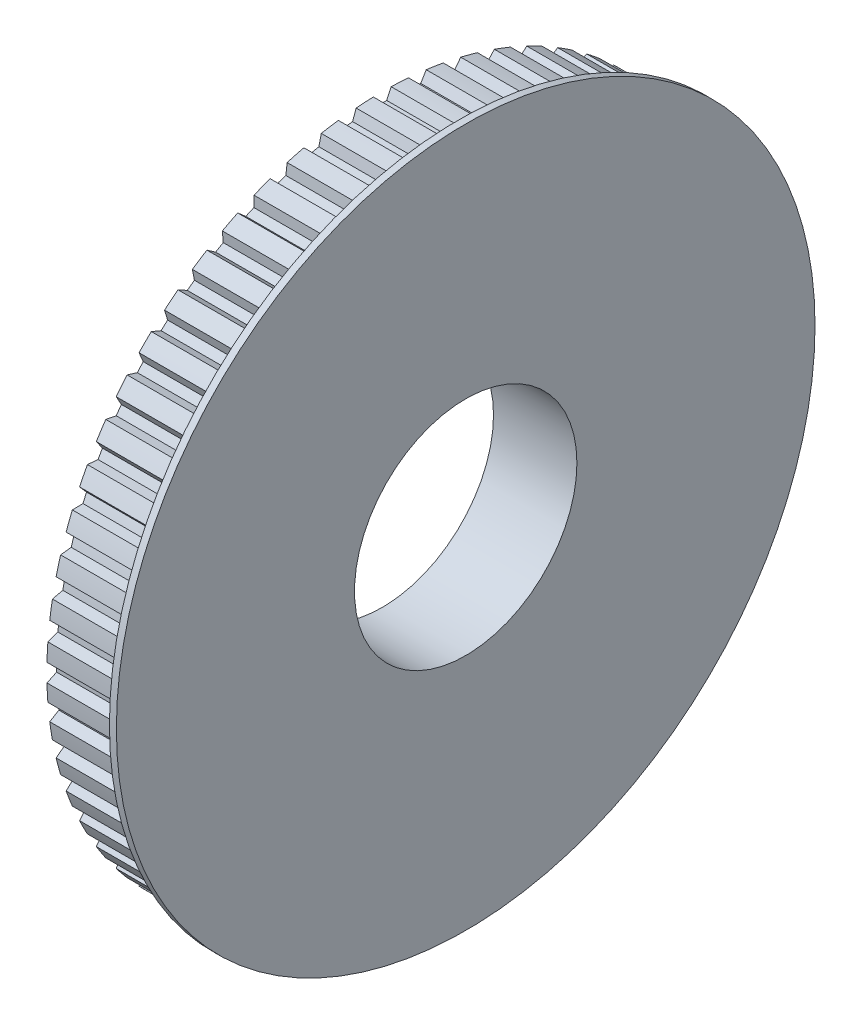
from build123d import *

# Parameters (mm, degrees)
SKETCH1_R           = 48.255
SKETCH1_R_2         = 16
BOSS_EXTRUDE1_DEPTH = 11
CUT_EXTRUDE1_DEPTH  = 70.123730006
SKETCH4_R           = 50.255
SKETCH4_R_2         = 16
BOSS_EXTRUDE2_DEPTH = 1


with BuildPart() as part:
    # Sketch1 → Boss-Extrude1 (new body)
    with BuildSketch(Plane(origin=(0, 0, 0), x_dir=(0, 0, -1), z_dir=(1, 0, 0))):
        Circle(SKETCH1_R)
        Circle(SKETCH1_R_2, mode=Mode.SUBTRACT)
    extrude(amount=BOSS_EXTRUDE1_DEPTH)

    # Sketch2 → Cut-Extrude1 (cut, through all)
    with BuildSketch(Plane.ZY):
        with BuildLine():
            Line((1.281876834, 48.237970695), (0.634980562, 46.850697163))
            ThreePointArc((0.634980562, 46.850697163), (0, 46.855), (-0.634980562, 46.850697163))
            Line((-0.634980562, 46.850697163), (-1.281876834, 48.237970695))
            ThreePointArc((-1.281876834, 48.237970695), (0, 48.255), (1.281876834, 48.237970695))
        make_face()
        with BuildLine():
            Line((6.317095526, 47.839725429), (5.528733449, 46.5276706))
            ThreePointArc((5.528733449, 46.5276706), (4.897681146, 46.598323407), (4.265729306, 46.660417684))
            Line((4.265729306, 46.660417684), (3.76738637, 48.10771066))
            ThreePointArc((3.76738637, 48.10771066), (5.044020995, 47.990654061), (6.317095526, 47.839725429))
        make_face()
        with BuildLine():
            Line((11.283102798, 46.91733812), (10.361912376, 45.694877141))
            ThreePointArc((10.361912376, 45.694877141), (9.741702273, 45.831105832), (9.11970295, 45.958916905))
            Line((9.11970295, 45.958916905), (8.775373299, 47.45037248))
            ThreePointArc((8.775373299, 47.45037248), (10.03277864, 47.200512473), (11.283102798, 46.91733812))
        make_face()
        with BuildLine():
            Line((16.125490035, 45.480914636), (15.081564023, 44.361441045))
            ThreePointArc((15.081564023, 44.361441045), (14.478991271, 44.561753071), (13.873759221, 44.753880615))
            Line((13.873759221, 44.753880615), (13.687215403, 46.273158089))
            ThreePointArc((13.687215403, 46.273158089), (14.911615064, 45.893232194), (16.125490035, 45.480914636))
        make_face()
        with BuildLine():
            Line((20.791203028, 43.546192734), (19.635978898, 42.541971719))
            ThreePointArc((19.635978898, 42.541971719), (19.057645411, 42.804172418), (18.475811682, 43.058511443))
            Line((18.475811682, 43.058511443), (18.449097511, 44.588965295))
            ThreePointArc((18.449097511, 44.588965295), (19.627076712, 44.083136059), (20.791203028, 43.546192734))
        make_face()
        with BuildLine():
            Line((25.22912325, 41.134369632), (23.975257879, 40.256403647))
            ThreePointArc((23.975257879, 40.256403647), (23.4275, 40.577620294), (22.875439284, 40.891384209))
            Line((22.875439284, 40.891384209), (23.008847445, 42.416246466))
            ThreePointArc((23.008847445, 42.416246466), (24.1275, 41.79005586), (25.22912325, 41.134369632))
        make_face()
        with BuildLine():
            Line((29.390627918, 38.271869768), (28.051858918, 37.529777994))
            ThreePointArc((28.051858918, 37.529777994), (27.540677996, 37.906491271), (27.024438787, 38.276242413))
            Line((27.024438787, 38.276242413), (27.316507632, 39.778806365))
            ThreePointArc((27.316507632, 39.778806365), (28.363577349, 39.039115064), (29.390627918, 38.271869768))
        make_face()
        with BuildLine():
            Line((33.230122717, 34.990055291), (31.82111792, 34.391968239))
            ThreePointArc((31.82111792, 34.391968239), (31.352114561, 34.820050798), (30.877352882, 35.241738095))
            Line((30.877352882, 35.241738095), (31.324882445, 36.705541337))
            ThreePointArc((31.324882445, 36.705541337), (32.28889741, 35.860453553), (33.230122717, 34.990055291))
        make_face()
        with BuildLine():
            Line((36.705541337, 31.324882445), (35.241738095, 30.877352882))
            ThreePointArc((35.241738095, 30.877352882), (34.820050798, 31.352114561), (34.391968239, 31.82111792))
            Line((34.391968239, 31.82111792), (34.990055291, 33.230122717))
            ThreePointArc((34.990055291, 33.230122717), (35.860453553, 32.28889741), (36.705541337, 31.324882445))
        make_face()
        with BuildLine():
            Line((39.778806365, 27.316507632), (38.276242413, 27.024438787))
            ThreePointArc((38.276242413, 27.024438787), (37.906491271, 27.540677996), (37.529777994, 28.051858918))
            Line((37.529777994, 28.051858918), (38.271869768, 29.390627918))
            ThreePointArc((38.271869768, 29.390627918), (39.039115064, 28.363577349), (39.778806365, 27.316507632))
        make_face()
        with BuildLine():
            Line((42.416246466, 23.008847445), (40.891384209, 22.875439284))
            ThreePointArc((40.891384209, 22.875439284), (40.577620294, 23.4275), (40.256403647, 23.975257879))
            Line((40.256403647, 23.975257879), (41.134369632, 25.22912325))
            ThreePointArc((41.134369632, 25.22912325), (41.79005586, 24.1275), (42.416246466, 23.008847445))
        make_face()
        with BuildLine():
            Line((44.588965295, 18.449097511), (43.058511443, 18.475811682))
            ThreePointArc((43.058511443, 18.475811682), (42.804172418, 19.057645411), (42.541971719, 19.635978898))
            Line((42.541971719, 19.635978898), (43.546192734, 20.791203028))
            ThreePointArc((43.546192734, 20.791203028), (44.083136059, 19.627076712), (44.588965295, 18.449097511))
        make_face()
        with BuildLine():
            Line((46.273158089, 13.687215403), (44.753880615, 13.873759221))
            ThreePointArc((44.753880615, 13.873759221), (44.561753071, 14.478991271), (44.361441045, 15.081564023))
            Line((44.361441045, 15.081564023), (45.480914636, 16.125490035))
            ThreePointArc((45.480914636, 16.125490035), (45.893232194, 14.911615064), (46.273158089, 13.687215403))
        make_face()
        with BuildLine():
            Line((47.45037248, 8.775373299), (45.958916905, 9.11970295))
            ThreePointArc((45.958916905, 9.11970295), (45.831105832, 9.741702273), (45.694877141, 10.361912376))
            Line((45.694877141, 10.361912376), (46.91733812, 11.283102798))
            ThreePointArc((46.91733812, 11.283102798), (47.200512473, 10.03277864), (47.45037248, 8.775373299))
        make_face()
        with BuildLine():
            Line((48.10771066, 3.76738637), (46.660417684, 4.265729306))
            ThreePointArc((46.660417684, 4.265729306), (46.598323407, 4.897681146), (46.5276706, 5.528733449))
            Line((46.5276706, 5.528733449), (47.839725429, 6.317095526))
            ThreePointArc((47.839725429, 6.317095526), (47.990654061, 5.044020995), (48.10771066, 3.76738637))
        make_face()
        with BuildLine():
            Line((48.237970695, -1.281876834), (46.850697163, -0.634980562))
            ThreePointArc((46.850697163, -0.634980562), (46.855, 0), (46.850697163, 0.634980562))
            Line((46.850697163, 0.634980562), (48.237970695, 1.281876834))
            ThreePointArc((48.237970695, 1.281876834), (48.255, 0), (48.237970695, -1.281876834))
        make_face()
        with BuildLine():
            Line((47.839725429, -6.317095526), (46.5276706, -5.528733449))
            ThreePointArc((46.5276706, -5.528733449), (46.598323407, -4.897681146), (46.660417684, -4.265729306))
            Line((46.660417684, -4.265729306), (48.10771066, -3.76738637))
            ThreePointArc((48.10771066, -3.76738637), (47.990654061, -5.044020995), (47.839725429, -6.317095526))
        make_face()
        with BuildLine():
            Line((46.91733812, -11.283102798), (45.694877141, -10.361912376))
            ThreePointArc((45.694877141, -10.361912376), (45.831105832, -9.741702273), (45.958916905, -9.11970295))
            Line((45.958916905, -9.11970295), (47.45037248, -8.775373299))
            ThreePointArc((47.45037248, -8.775373299), (47.200512473, -10.03277864), (46.91733812, -11.283102798))
        make_face()
        with BuildLine():
            Line((45.480914636, -16.125490035), (44.361441045, -15.081564023))
            ThreePointArc((44.361441045, -15.081564023), (44.561753071, -14.478991271), (44.753880615, -13.873759221))
            Line((44.753880615, -13.873759221), (46.273158089, -13.687215403))
            ThreePointArc((46.273158089, -13.687215403), (45.893232194, -14.911615064), (45.480914636, -16.125490035))
        make_face()
        with BuildLine():
            Line((43.546192734, -20.791203028), (42.541971719, -19.635978898))
            ThreePointArc((42.541971719, -19.635978898), (42.804172418, -19.057645411), (43.058511443, -18.475811682))
            Line((43.058511443, -18.475811682), (44.588965295, -18.449097511))
            ThreePointArc((44.588965295, -18.449097511), (44.083136059, -19.627076712), (43.546192734, -20.791203028))
        make_face()
        with BuildLine():
            Line((41.134369632, -25.22912325), (40.256403647, -23.975257879))
            ThreePointArc((40.256403647, -23.975257879), (40.577620294, -23.4275), (40.891384209, -22.875439284))
            Line((40.891384209, -22.875439284), (42.416246466, -23.008847445))
            ThreePointArc((42.416246466, -23.008847445), (41.79005586, -24.1275), (41.134369632, -25.22912325))
        make_face()
        with BuildLine():
            Line((38.271869768, -29.390627918), (37.529777994, -28.051858918))
            ThreePointArc((37.529777994, -28.051858918), (37.906491271, -27.540677996), (38.276242413, -27.024438787))
            Line((38.276242413, -27.024438787), (39.778806365, -27.316507632))
            ThreePointArc((39.778806365, -27.316507632), (39.039115064, -28.363577349), (38.271869768, -29.390627918))
        make_face()
        with BuildLine():
            Line((34.990055291, -33.230122717), (34.391968239, -31.82111792))
            ThreePointArc((34.391968239, -31.82111792), (34.820050798, -31.352114561), (35.241738095, -30.877352882))
            Line((35.241738095, -30.877352882), (36.705541337, -31.324882445))
            ThreePointArc((36.705541337, -31.324882445), (35.860453553, -32.28889741), (34.990055291, -33.230122717))
        make_face()
        with BuildLine():
            Line((31.324882445, -36.705541337), (30.877352882, -35.241738095))
            ThreePointArc((30.877352882, -35.241738095), (31.352114561, -34.820050798), (31.82111792, -34.391968239))
            Line((31.82111792, -34.391968239), (33.230122717, -34.990055291))
            ThreePointArc((33.230122717, -34.990055291), (32.28889741, -35.860453553), (31.324882445, -36.705541337))
        make_face()
        with BuildLine():
            Line((27.316507632, -39.778806365), (27.024438787, -38.276242413))
            ThreePointArc((27.024438787, -38.276242413), (27.540677996, -37.906491271), (28.051858918, -37.529777994))
            Line((28.051858918, -37.529777994), (29.390627918, -38.271869768))
            ThreePointArc((29.390627918, -38.271869768), (28.363577349, -39.039115064), (27.316507632, -39.778806365))
        make_face()
        with BuildLine():
            Line((23.008847445, -42.416246466), (22.875439284, -40.891384209))
            ThreePointArc((22.875439284, -40.891384209), (23.4275, -40.577620294), (23.975257879, -40.256403647))
            Line((23.975257879, -40.256403647), (25.22912325, -41.134369632))
            ThreePointArc((25.22912325, -41.134369632), (24.1275, -41.79005586), (23.008847445, -42.416246466))
        make_face()
        with BuildLine():
            Line((18.449097511, -44.588965295), (18.475811682, -43.058511443))
            ThreePointArc((18.475811682, -43.058511443), (19.057645411, -42.804172418), (19.635978898, -42.541971719))
            Line((19.635978898, -42.541971719), (20.791203028, -43.546192734))
            ThreePointArc((20.791203028, -43.546192734), (19.627076712, -44.083136059), (18.449097511, -44.588965295))
        make_face()
        with BuildLine():
            Line((13.687215403, -46.273158089), (13.873759221, -44.753880615))
            ThreePointArc((13.873759221, -44.753880615), (14.478991271, -44.561753071), (15.081564023, -44.361441045))
            Line((15.081564023, -44.361441045), (16.125490035, -45.480914636))
            ThreePointArc((16.125490035, -45.480914636), (14.911615064, -45.893232194), (13.687215403, -46.273158089))
        make_face()
        with BuildLine():
            Line((8.775373299, -47.45037248), (9.11970295, -45.958916905))
            ThreePointArc((9.11970295, -45.958916905), (9.741702273, -45.831105832), (10.361912376, -45.694877141))
            Line((10.361912376, -45.694877141), (11.283102798, -46.91733812))
            ThreePointArc((11.283102798, -46.91733812), (10.03277864, -47.200512473), (8.775373299, -47.45037248))
        make_face()
        with BuildLine():
            Line((3.76738637, -48.10771066), (4.265729306, -46.660417684))
            ThreePointArc((4.265729306, -46.660417684), (4.897681146, -46.598323407), (5.528733449, -46.5276706))
            Line((5.528733449, -46.5276706), (6.317095526, -47.839725429))
            ThreePointArc((6.317095526, -47.839725429), (5.044020995, -47.990654061), (3.76738637, -48.10771066))
        make_face()
        with BuildLine():
            Line((-1.281876834, -48.237970695), (-0.634980562, -46.850697163))
            ThreePointArc((-0.634980562, -46.850697163), (0, -46.855), (0.634980562, -46.850697163))
            Line((0.634980562, -46.850697163), (1.281876834, -48.237970695))
            ThreePointArc((1.281876834, -48.237970695), (0, -48.255), (-1.281876834, -48.237970695))
        make_face()
        with BuildLine():
            Line((-6.317095526, -47.839725429), (-5.528733449, -46.5276706))
            ThreePointArc((-5.528733449, -46.5276706), (-4.897681146, -46.598323407), (-4.265729306, -46.660417684))
            Line((-4.265729306, -46.660417684), (-3.76738637, -48.10771066))
            ThreePointArc((-3.76738637, -48.10771066), (-5.044020995, -47.990654061), (-6.317095526, -47.839725429))
        make_face()
        with BuildLine():
            Line((-11.283102798, -46.91733812), (-10.361912376, -45.694877141))
            ThreePointArc((-10.361912376, -45.694877141), (-9.741702273, -45.831105832), (-9.11970295, -45.958916905))
            Line((-9.11970295, -45.958916905), (-8.775373299, -47.45037248))
            ThreePointArc((-8.775373299, -47.45037248), (-10.03277864, -47.200512473), (-11.283102798, -46.91733812))
        make_face()
        with BuildLine():
            Line((-16.125490035, -45.480914636), (-15.081564023, -44.361441045))
            ThreePointArc((-15.081564023, -44.361441045), (-14.478991271, -44.561753071), (-13.873759221, -44.753880615))
            Line((-13.873759221, -44.753880615), (-13.687215403, -46.273158089))
            ThreePointArc((-13.687215403, -46.273158089), (-14.911615064, -45.893232194), (-16.125490035, -45.480914636))
        make_face()
        with BuildLine():
            Line((-20.791203028, -43.546192734), (-19.635978898, -42.541971719))
            ThreePointArc((-19.635978898, -42.541971719), (-19.057645411, -42.804172418), (-18.475811682, -43.058511443))
            Line((-18.475811682, -43.058511443), (-18.449097511, -44.588965295))
            ThreePointArc((-18.449097511, -44.588965295), (-19.627076712, -44.083136059), (-20.791203028, -43.546192734))
        make_face()
        with BuildLine():
            Line((-25.22912325, -41.134369632), (-23.975257879, -40.256403647))
            ThreePointArc((-23.975257879, -40.256403647), (-23.4275, -40.577620294), (-22.875439284, -40.891384209))
            Line((-22.875439284, -40.891384209), (-23.008847445, -42.416246466))
            ThreePointArc((-23.008847445, -42.416246466), (-24.1275, -41.79005586), (-25.22912325, -41.134369632))
        make_face()
        with BuildLine():
            Line((-29.390627918, -38.271869768), (-28.051858918, -37.529777994))
            ThreePointArc((-28.051858918, -37.529777994), (-27.540677996, -37.906491271), (-27.024438787, -38.276242413))
            Line((-27.024438787, -38.276242413), (-27.316507632, -39.778806365))
            ThreePointArc((-27.316507632, -39.778806365), (-28.363577349, -39.039115064), (-29.390627918, -38.271869768))
        make_face()
        with BuildLine():
            Line((-33.230122717, -34.990055291), (-31.82111792, -34.391968239))
            ThreePointArc((-31.82111792, -34.391968239), (-31.352114561, -34.820050798), (-30.877352882, -35.241738095))
            Line((-30.877352882, -35.241738095), (-31.324882445, -36.705541337))
            ThreePointArc((-31.324882445, -36.705541337), (-32.28889741, -35.860453553), (-33.230122717, -34.990055291))
        make_face()
        with BuildLine():
            Line((-36.705541337, -31.324882445), (-35.241738095, -30.877352882))
            ThreePointArc((-35.241738095, -30.877352882), (-34.820050798, -31.352114561), (-34.391968239, -31.82111792))
            Line((-34.391968239, -31.82111792), (-34.990055291, -33.230122717))
            ThreePointArc((-34.990055291, -33.230122717), (-35.860453553, -32.28889741), (-36.705541337, -31.324882445))
        make_face()
        with BuildLine():
            Line((-39.778806365, -27.316507632), (-38.276242413, -27.024438787))
            ThreePointArc((-38.276242413, -27.024438787), (-37.906491271, -27.540677996), (-37.529777994, -28.051858918))
            Line((-37.529777994, -28.051858918), (-38.271869768, -29.390627918))
            ThreePointArc((-38.271869768, -29.390627918), (-39.039115064, -28.363577349), (-39.778806365, -27.316507632))
        make_face()
        with BuildLine():
            Line((-42.416246466, -23.008847445), (-40.891384209, -22.875439284))
            ThreePointArc((-40.891384209, -22.875439284), (-40.577620294, -23.4275), (-40.256403647, -23.975257879))
            Line((-40.256403647, -23.975257879), (-41.134369632, -25.22912325))
            ThreePointArc((-41.134369632, -25.22912325), (-41.79005586, -24.1275), (-42.416246466, -23.008847445))
        make_face()
        with BuildLine():
            Line((-44.588965295, -18.449097511), (-43.058511443, -18.475811682))
            ThreePointArc((-43.058511443, -18.475811682), (-42.804172418, -19.057645411), (-42.541971719, -19.635978898))
            Line((-42.541971719, -19.635978898), (-43.546192734, -20.791203028))
            ThreePointArc((-43.546192734, -20.791203028), (-44.083136059, -19.627076712), (-44.588965295, -18.449097511))
        make_face()
        with BuildLine():
            Line((-46.273158089, -13.687215403), (-44.753880615, -13.873759221))
            ThreePointArc((-44.753880615, -13.873759221), (-44.561753071, -14.478991271), (-44.361441045, -15.081564023))
            Line((-44.361441045, -15.081564023), (-45.480914636, -16.125490035))
            ThreePointArc((-45.480914636, -16.125490035), (-45.893232194, -14.911615064), (-46.273158089, -13.687215403))
        make_face()
        with BuildLine():
            Line((-47.45037248, -8.775373299), (-45.958916905, -9.11970295))
            ThreePointArc((-45.958916905, -9.11970295), (-45.831105832, -9.741702273), (-45.694877141, -10.361912376))
            Line((-45.694877141, -10.361912376), (-46.91733812, -11.283102798))
            ThreePointArc((-46.91733812, -11.283102798), (-47.200512473, -10.03277864), (-47.45037248, -8.775373299))
        make_face()
        with BuildLine():
            Line((-48.10771066, -3.76738637), (-46.660417684, -4.265729306))
            ThreePointArc((-46.660417684, -4.265729306), (-46.598323407, -4.897681146), (-46.5276706, -5.528733449))
            Line((-46.5276706, -5.528733449), (-47.839725429, -6.317095526))
            ThreePointArc((-47.839725429, -6.317095526), (-47.990654061, -5.044020995), (-48.10771066, -3.76738637))
        make_face()
        with BuildLine():
            Line((-48.237970695, 1.281876834), (-46.850697163, 0.634980562))
            ThreePointArc((-46.850697163, 0.634980562), (-46.855, 0), (-46.850697163, -0.634980562))
            Line((-46.850697163, -0.634980562), (-48.237970695, -1.281876834))
            ThreePointArc((-48.237970695, -1.281876834), (-48.255, 0), (-48.237970695, 1.281876834))
        make_face()
        with BuildLine():
            Line((-47.839725429, 6.317095526), (-46.5276706, 5.528733449))
            ThreePointArc((-46.5276706, 5.528733449), (-46.598323407, 4.897681146), (-46.660417684, 4.265729306))
            Line((-46.660417684, 4.265729306), (-48.10771066, 3.76738637))
            ThreePointArc((-48.10771066, 3.76738637), (-47.990654061, 5.044020995), (-47.839725429, 6.317095526))
        make_face()
        with BuildLine():
            Line((-46.91733812, 11.283102798), (-45.694877141, 10.361912376))
            ThreePointArc((-45.694877141, 10.361912376), (-45.831105832, 9.741702273), (-45.958916905, 9.11970295))
            Line((-45.958916905, 9.11970295), (-47.45037248, 8.775373299))
            ThreePointArc((-47.45037248, 8.775373299), (-47.200512473, 10.03277864), (-46.91733812, 11.283102798))
        make_face()
        with BuildLine():
            Line((-45.480914636, 16.125490035), (-44.361441045, 15.081564023))
            ThreePointArc((-44.361441045, 15.081564023), (-44.561753071, 14.478991271), (-44.753880615, 13.873759221))
            Line((-44.753880615, 13.873759221), (-46.273158089, 13.687215403))
            ThreePointArc((-46.273158089, 13.687215403), (-45.893232194, 14.911615064), (-45.480914636, 16.125490035))
        make_face()
        with BuildLine():
            Line((-43.546192734, 20.791203028), (-42.541971719, 19.635978898))
            ThreePointArc((-42.541971719, 19.635978898), (-42.804172418, 19.057645411), (-43.058511443, 18.475811682))
            Line((-43.058511443, 18.475811682), (-44.588965295, 18.449097511))
            ThreePointArc((-44.588965295, 18.449097511), (-44.083136059, 19.627076712), (-43.546192734, 20.791203028))
        make_face()
        with BuildLine():
            Line((-41.134369632, 25.22912325), (-40.256403647, 23.975257879))
            ThreePointArc((-40.256403647, 23.975257879), (-40.577620294, 23.4275), (-40.891384209, 22.875439284))
            Line((-40.891384209, 22.875439284), (-42.416246466, 23.008847445))
            ThreePointArc((-42.416246466, 23.008847445), (-41.79005586, 24.1275), (-41.134369632, 25.22912325))
        make_face()
        with BuildLine():
            Line((-38.271869768, 29.390627918), (-37.529777994, 28.051858918))
            ThreePointArc((-37.529777994, 28.051858918), (-37.906491271, 27.540677996), (-38.276242413, 27.024438787))
            Line((-38.276242413, 27.024438787), (-39.778806365, 27.316507632))
            ThreePointArc((-39.778806365, 27.316507632), (-39.039115064, 28.363577349), (-38.271869768, 29.390627918))
        make_face()
        with BuildLine():
            Line((-34.990055291, 33.230122717), (-34.391968239, 31.82111792))
            ThreePointArc((-34.391968239, 31.82111792), (-34.820050798, 31.352114561), (-35.241738095, 30.877352882))
            Line((-35.241738095, 30.877352882), (-36.705541337, 31.324882445))
            ThreePointArc((-36.705541337, 31.324882445), (-35.860453553, 32.28889741), (-34.990055291, 33.230122717))
        make_face()
        with BuildLine():
            Line((-31.324882445, 36.705541337), (-30.877352882, 35.241738095))
            ThreePointArc((-30.877352882, 35.241738095), (-31.352114561, 34.820050798), (-31.82111792, 34.391968239))
            Line((-31.82111792, 34.391968239), (-33.230122717, 34.990055291))
            ThreePointArc((-33.230122717, 34.990055291), (-32.28889741, 35.860453553), (-31.324882445, 36.705541337))
        make_face()
        with BuildLine():
            Line((-27.316507632, 39.778806365), (-27.024438787, 38.276242413))
            ThreePointArc((-27.024438787, 38.276242413), (-27.540677996, 37.906491271), (-28.051858918, 37.529777994))
            Line((-28.051858918, 37.529777994), (-29.390627918, 38.271869768))
            ThreePointArc((-29.390627918, 38.271869768), (-28.363577349, 39.039115064), (-27.316507632, 39.778806365))
        make_face()
        with BuildLine():
            Line((-23.008847445, 42.416246466), (-22.875439284, 40.891384209))
            ThreePointArc((-22.875439284, 40.891384209), (-23.4275, 40.577620294), (-23.975257879, 40.256403647))
            Line((-23.975257879, 40.256403647), (-25.22912325, 41.134369632))
            ThreePointArc((-25.22912325, 41.134369632), (-24.1275, 41.79005586), (-23.008847445, 42.416246466))
        make_face()
        with BuildLine():
            Line((-18.449097511, 44.588965295), (-18.475811682, 43.058511443))
            ThreePointArc((-18.475811682, 43.058511443), (-19.057645411, 42.804172418), (-19.635978898, 42.541971719))
            Line((-19.635978898, 42.541971719), (-20.791203028, 43.546192734))
            ThreePointArc((-20.791203028, 43.546192734), (-19.627076712, 44.083136059), (-18.449097511, 44.588965295))
        make_face()
        with BuildLine():
            Line((-13.687215403, 46.273158089), (-13.873759221, 44.753880615))
            ThreePointArc((-13.873759221, 44.753880615), (-14.478991271, 44.561753071), (-15.081564023, 44.361441045))
            Line((-15.081564023, 44.361441045), (-16.125490035, 45.480914636))
            ThreePointArc((-16.125490035, 45.480914636), (-14.911615064, 45.893232194), (-13.687215403, 46.273158089))
        make_face()
        with BuildLine():
            Line((-8.775373299, 47.45037248), (-9.11970295, 45.958916905))
            ThreePointArc((-9.11970295, 45.958916905), (-9.741702273, 45.831105832), (-10.361912376, 45.694877141))
            Line((-10.361912376, 45.694877141), (-11.283102798, 46.91733812))
            ThreePointArc((-11.283102798, 46.91733812), (-10.03277864, 47.200512473), (-8.775373299, 47.45037248))
        make_face()
        with BuildLine():
            Line((-3.76738637, 48.10771066), (-4.265729306, 46.660417684))
            ThreePointArc((-4.265729306, 46.660417684), (-4.897681146, 46.598323407), (-5.528733449, 46.5276706))
            Line((-5.528733449, 46.5276706), (-6.317095526, 47.839725429))
            ThreePointArc((-6.317095526, 47.839725429), (-5.044020995, 47.990654061), (-3.76738637, 48.10771066))
        make_face()
    extrude(amount=-CUT_EXTRUDE1_DEPTH, mode=Mode.SUBTRACT)

    # Sketch4 → Boss-Extrude2 (add)
    with BuildSketch(Plane(origin=(11, 0, 0), x_dir=(0, 0, -1), z_dir=(1, 0, 0))):
        Circle(SKETCH4_R)
        Circle(SKETCH4_R_2, mode=Mode.SUBTRACT)
    extrude(amount=BOSS_EXTRUDE2_DEPTH)


solid = part.part
